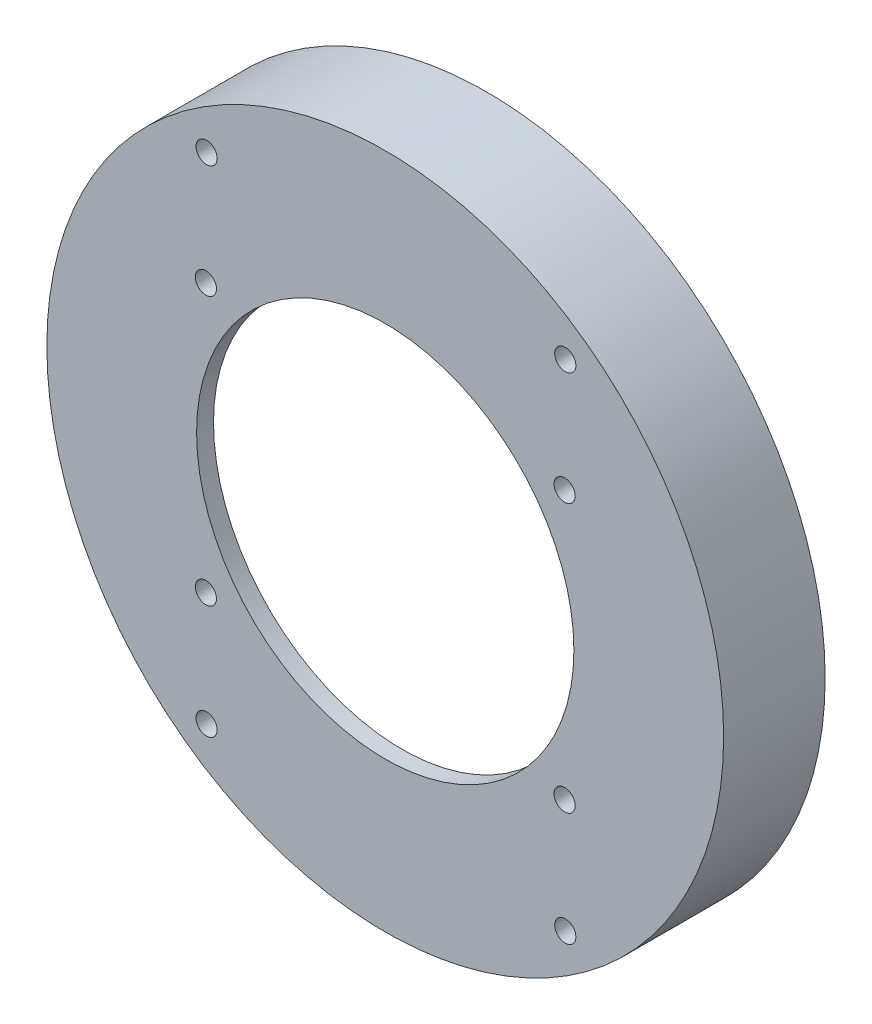
from build123d import *

# Parameters (mm, degrees)
SKETCH1_R           = 101.6
BOSS_EXTRUDE1_DEPTH = 5.08
BOSS_EXTRUDE2_START = 25.4
SKETCH4_R           = 101.6
BOSS_EXTRUDE2_DEPTH = 25.4
SKETCH5_R           = 56.642
BOSS_EXTRUDE3_DEPTH = 12.7
CUT_EXTRUDE3_START  = -64.008
SKETCH6_R           = 56.642
CUT_EXTRUDE3_DEPTH  = 64.008
CUT_EXTRUDE6_START  = -25.4
SKETCH10_R          = 98.425
SKETCH10_R_2        = 56.642
CUT_EXTRUDE6_DEPTH  = 25.4
SKETCH16_R          = 3.175
CUT_EXTRUDE7_DEPTH  = 6.35
SKETCH17_R          = 3.175
CUT_EXTRUDE8_DEPTH  = 7.874


with BuildPart() as part:
    # Sketch1 → Boss-Extrude1 (new body)
    with BuildSketch(Plane.XY):
        Circle(SKETCH1_R)
    extrude(amount=BOSS_EXTRUDE1_DEPTH)

    # Sketch4 → Boss-Extrude2 (add)
    with BuildSketch(Plane(origin=(0, 0, 0), x_dir=(-1, 0, 0), z_dir=(0, 0, -1)).offset(BOSS_EXTRUDE2_START)):
        Circle(SKETCH4_R)
    extrude(amount=-BOSS_EXTRUDE2_DEPTH)

    # Sketch5 → Boss-Extrude3 (add)
    with BuildSketch(Plane(origin=(0, 0, -25.4), x_dir=(-1, 0, 0), z_dir=(0, 0, -1))):
        Circle(SKETCH5_R)
    extrude(amount=BOSS_EXTRUDE3_DEPTH)

    # Sketch6 → Cut-Extrude3 (cut)
    with BuildSketch(Plane(origin=(0, 0, -38.1), x_dir=(-1, 0, 0), z_dir=(0, 0, -1)).offset(CUT_EXTRUDE3_START)):
        Circle(SKETCH6_R)
    extrude(amount=CUT_EXTRUDE3_DEPTH, mode=Mode.SUBTRACT)

    # Sketch10 → Cut-Extrude6 (cut)
    with BuildSketch(Plane(origin=(0, 0, -25.4), x_dir=(-1, 0, 0), z_dir=(0, 0, -1)).offset(CUT_EXTRUDE6_START)):
        Circle(SKETCH10_R)
        Circle(SKETCH10_R_2, mode=Mode.SUBTRACT)
    extrude(amount=CUT_EXTRUDE6_DEPTH, mode=Mode.SUBTRACT)

    # Sketch16 → Cut-Extrude7 (cut)
    with BuildSketch(Plane(origin=(0, 0, 0), x_dir=(-1, 0, 0), z_dir=(0, 0, -1))):
        with Locations((53.848, 40.259)):
            Circle(SKETCH16_R)
        with Locations((-53.848, 40.259)):
            Circle(SKETCH16_R)
        with Locations((-53.848, -40.259)):
            Circle(SKETCH16_R)
        with Locations((53.848, -40.259)):
            Circle(SKETCH16_R)
    extrude(amount=-CUT_EXTRUDE7_DEPTH, mode=Mode.SUBTRACT)

    # Sketch17 → Cut-Extrude8 (cut)
    with BuildSketch(Plane.XY.offset(5.08)):
        with Locations((54.055769112, 74.294164254)):
            Circle(SKETCH17_R)
        with Locations((-53.640230888, 74.294164254)):
            Circle(SKETCH17_R)
        with Locations((-53.640230888, -74.295835746)):
            Circle(SKETCH17_R)
        with Locations((54.055769112, -74.295835746)):
            Circle(SKETCH17_R)
    extrude(amount=-CUT_EXTRUDE8_DEPTH, mode=Mode.SUBTRACT)


solid = part.part
